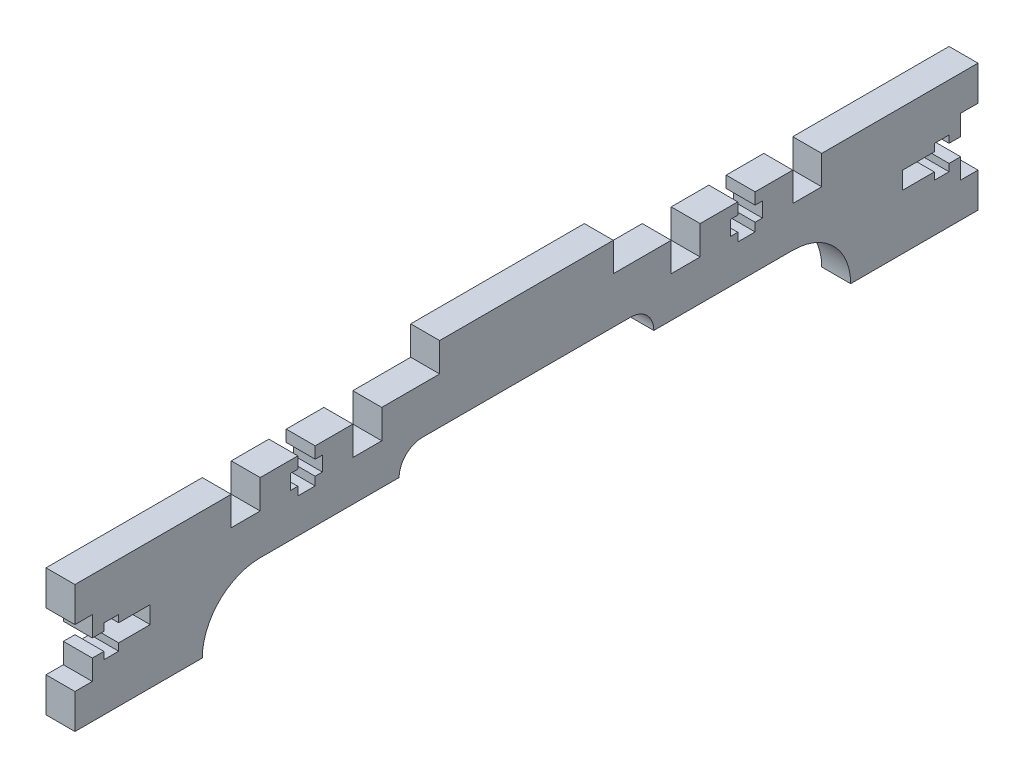
from build123d import *

# Parameters (mm, degrees)
SKETCH1_W           = 5
SKETCH1_H           = 22
BOSS_EXTRUDE1_DEPTH = 150
CUT_EXTRUDE1_DEPTH  = 161.573187019
CUT_EXTRUDE2_DEPTH  = 161.573187019
SKETCH4_W           = 5
SKETCH4_H           = 6
BOSS_EXTRUDE2_DEPTH = 3
SKETCH5_W           = 5
SKETCH5_H           = 6
BOSS_EXTRUDE3_DEPTH = 3
SKETCH6_W           = 30
SKETCH6_H           = 5
BOSS_EXTRUDE4_DEPTH = 5
SKETCH7_W           = 5
SKETCH7_H           = 5
CUT_EXTRUDE3_DEPTH  = 166.192623536
SKETCH8_W           = 5
SKETCH8_H           = 5
CUT_EXTRUDE4_DEPTH  = 166.192623536


with BuildPart() as part:
    # Sketch1 → Boss-Extrude1 (new body)
    with BuildSketch(Plane.XY):
        with Locations((31.394042166, 46.08544814)):
            Rectangle(SKETCH1_W, SKETCH1_H)
    extrude(amount=BOSS_EXTRUDE1_DEPTH)

    # Sketch2 → Cut-Extrude1 (cut, through all)
    with BuildSketch(Plane(origin=(33.894042166, 0, 0), x_dir=(0, 0, -1), z_dir=(1, 0, 0))):
        with BuildLine():
            Line((-93, 49.08544814), (-57, 49.08544814))
            ThreePointArc((-57, 49.08544814), (-54.171572875, 47.913875265), (-53, 45.08544814))
            Line((-53, 45.08544814), (-29, 45.08544814))
            ThreePointArc((-29, 45.08544814), (-21.928932188, 42.156515952), (-19, 35.08544814))
            Line((-19, 35.08544814), (-131, 35.08544814))
            ThreePointArc((-131, 35.08544814), (-128.071067812, 42.156515952), (-121, 45.08544814))
            Line((-121, 45.08544814), (-97, 45.08544814))
            ThreePointArc((-97, 45.08544814), (-95.828427125, 47.913875265), (-93, 49.08544814))
        make_face()
    extrude(amount=-CUT_EXTRUDE1_DEPTH, mode=Mode.SUBTRACT)

    # Sketch3 → Cut-Extrude2 (cut, through all)
    with BuildSketch(Plane(origin=(33.894042166, 0, 0), x_dir=(0, 0, -1), z_dir=(1, 0, 0))):
        Polygon((-38.5, 51.08544814), (-35.5, 51.08544814), (-35.5, 52.53544814), (-34.25, 52.53544814), (-34.25, 55.08544814), (-35.5, 55.08544814), (-35.5, 57.08544814), (-38.5, 57.08544814), (-38.5, 55.08544814), (-39.75, 55.08544814), (-39.75, 52.53544814), (-38.5, 52.53544814), align=None)
        Polygon((-111.5, 57.08544814), (-114.5, 57.08544814), (-114.5, 55.08544814), (-115.75, 55.08544814), (-115.75, 52.53544814), (-114.5, 52.53544814), (-114.5, 51.08544814), (-111.5, 51.08544814), (-111.5, 52.53544814), (-110.25, 52.53544814), (-110.25, 55.08544814), (-111.5, 55.08544814), align=None)
        Polygon((-10, 44.58544814), (-4.55, 44.58544814), (-4.55, 43.33544814), (-2, 43.33544814), (-2, 44.58544814), (0, 44.58544814), (0, 47.58544814), (-2, 47.58544814), (-2, 48.83544814), (-4.55, 48.83544814), (-4.55, 47.58544814), (-10, 47.58544814), align=None)
        Polygon((-145.45, 47.58544814), (-145.45, 48.83544814), (-148, 48.83544814), (-148, 47.58544814), (-150, 47.58544814), (-150, 44.58544814), (-148, 44.58544814), (-148, 43.33544814), (-145.45, 43.33544814), (-145.45, 44.58544814), (-140, 44.58544814), (-140, 47.58544814), align=None)
    extrude(amount=-CUT_EXTRUDE2_DEPTH, mode=Mode.SUBTRACT)

    # Sketch4 → Boss-Extrude2 (add)
    with BuildSketch(Plane(origin=(0, 0, 0), x_dir=(-1, 0, 0), z_dir=(0, 0, -1))):
        with Locations((-31.394042166, 38.08544814)):
            Rectangle(SKETCH4_W, SKETCH4_H)
        with Locations((-31.394042166, 54.08544814)):
            Rectangle(SKETCH4_W, SKETCH4_H)
    extrude(amount=BOSS_EXTRUDE2_DEPTH)

    # Sketch5 → Boss-Extrude3 (add)
    with BuildSketch(Plane.XY.offset(150)):
        with Locations((31.394042166, 54.08544814)):
            Rectangle(SKETCH5_W, SKETCH5_H)
        with Locations((31.394042166, 38.08544814)):
            Rectangle(SKETCH5_W, SKETCH5_H)
    extrude(amount=BOSS_EXTRUDE3_DEPTH)

    # Sketch6 → Boss-Extrude4 (add)
    with BuildSketch(Plane(origin=(33.894042166, 0, 0), x_dir=(0, 0, -1), z_dir=(1, 0, 0))):
        with Locations((-75, 59.58544814)):
            Rectangle(SKETCH6_W, SKETCH6_H)
    extrude(amount=-BOSS_EXTRUDE4_DEPTH)

    # Sketch7 → Cut-Extrude3 (cut, through all)
    with BuildSketch(Plane.ZY.offset(-28.894042166)):
        with Locations((123.5, 54.58544814)):
            Rectangle(SKETCH7_W, SKETCH7_H)
        with Locations((26.5, 54.58544814)):
            Rectangle(SKETCH7_W, SKETCH7_H)
    extrude(amount=-CUT_EXTRUDE3_DEPTH, mode=Mode.SUBTRACT)

    # Sketch8 → Cut-Extrude4 (cut, through all)
    with BuildSketch(Plane.ZY.offset(-28.894042166)):
        with Locations((47.5, 54.58544814)):
            Rectangle(SKETCH8_W, SKETCH8_H)
        with Locations((102.5, 54.58544814)):
            Rectangle(SKETCH8_W, SKETCH8_H)
    extrude(amount=-CUT_EXTRUDE4_DEPTH, mode=Mode.SUBTRACT)


solid = part.part
